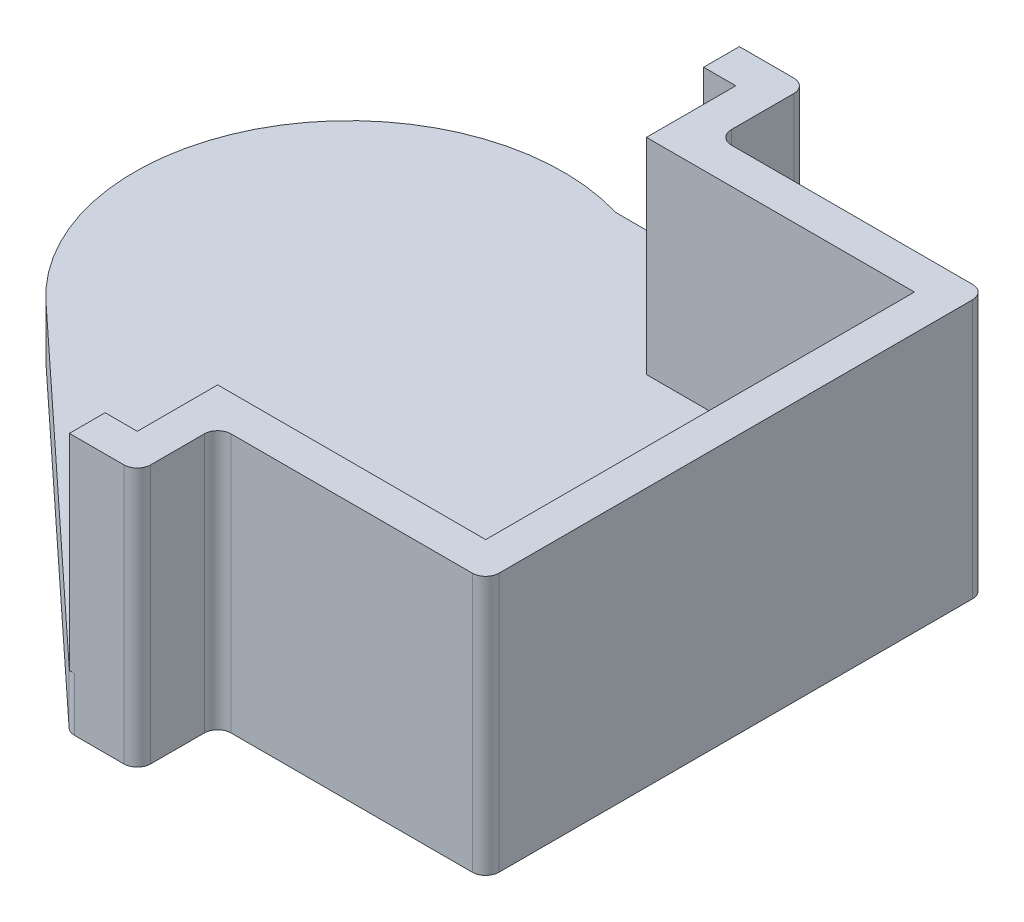
from build123d import *

# Parameters (mm, degrees)
BRACKET_DEPTH       = 11.5
BOSS_EXTRUDE1_START = -3
BOSS_EXTRUDE1_DEPTH = 3


with BuildPart() as part:
    # Sketch9 → Bracket (new body)
    with BuildSketch(Plane(origin=(0, 0, 0), x_dir=(1, 0, 0), z_dir=(0, 1, 0))):
        with BuildLine():
            Line((5.15, -5), (4.65, -5))
            Line((4.65, -5), (3.35, -5))
            Line((3.35, -5), (3.35, -7))
            Line((3.35, -7), (6.4, -7))
            ThreePointArc((6.4, -7), (6.930330086, -6.780330086), (7.15, -6.25))
            Line((7.15, -6.25), (7.15, -5))
            Line((7.15, -5), (7.15, -3.25))
            ThreePointArc((7.15, -3.25), (7.369669914, -2.719669914), (7.9, -2.5))
            Line((7.9, -2.5), (21.4, -2.5))
            ThreePointArc((21.4, -2.5), (21.930330086, -2.280330086), (22.15, -1.75))
            Line((22.15, -1.75), (22.15, 24.75))
            ThreePointArc((22.15, 24.75), (21.930330086, 25.280330086), (21.4, 25.5))
            Line((21.4, 25.5), (7.9, 25.5))
            ThreePointArc((7.9, 25.5), (7.369669914, 25.719669914), (7.15, 26.25))
            Line((7.15, 26.25), (7.15, 28))
            Line((7.15, 28), (7.15, 29.75))
            ThreePointArc((7.15, 29.75), (6.930330086, 30.280330086), (6.4, 30.5))
            Line((6.4, 30.5), (5.15, 30.5))
            Line((5.15, 30.5), (3.35, 30.5))
            Line((3.35, 30.5), (3.35, 28.5))
            Line((3.35, 28.5), (5.15, 28.5))
            Line((5.15, 28.5), (5.15, 28))
            Line((5.15, 28), (5.15, 23.5))
            Line((5.15, 23.5), (20.15, 23.5))
            Line((20.15, 23.5), (20.15, -0.5))
            Line((20.15, -0.5), (5.15, -0.5))
            Line((5.15, -0.5), (5.15, -5))
        make_face()
    extrude(amount=BRACKET_DEPTH)

    # Sketch12 → Boss-Extrude1 (add)
    with BuildSketch(Plane(origin=(0, 0, 0), x_dir=(1, 0, 0), z_dir=(0, 1, 0)).offset(BOSS_EXTRUDE1_START)):
        with BuildLine():
            Line((3.134136634, -6.799408153), (-15.169112008, 10.208954707))
            ThreePointArc((-15.169112008, 10.208954707), (-17.445237733, 24.907700028), (-3.6745965, 30.529381479))
            ThreePointArc((-3.6745965, 30.529381479), (-3.571695801, 30.507381696), (-3.466728879, 30.5))
            Line((-3.466728879, 30.5), (6.4, 30.5))
            ThreePointArc((6.4, 30.5), (6.930330086, 30.280330086), (7.15, 29.75))
            Line((7.15, 29.75), (7.15, 26.25))
            ThreePointArc((7.15, 26.25), (7.369669914, 25.719669914), (7.9, 25.5))
            Line((7.9, 25.5), (21.4, 25.5))
            ThreePointArc((21.4, 25.5), (21.930330086, 25.280330086), (22.15, 24.75))
            Line((22.15, 24.75), (22.15, -1.75))
            ThreePointArc((22.15, -1.75), (21.930330086, -2.280330086), (21.4, -2.5))
            Line((21.4, -2.5), (7.9, -2.5))
            ThreePointArc((7.9, -2.5), (7.369669914, -2.719669914), (7.15, -3.25))
            Line((7.15, -3.25), (7.15, -6.25))
            ThreePointArc((7.15, -6.25), (6.930330086, -6.780330086), (6.4, -7))
            Line((6.4, -7), (3.644676233, -7))
            ThreePointArc((3.644676233, -7), (3.370410043, -6.948053048), (3.134136634, -6.799408153))
        make_face()
    extrude(amount=BOSS_EXTRUDE1_DEPTH)


solid = part.part
